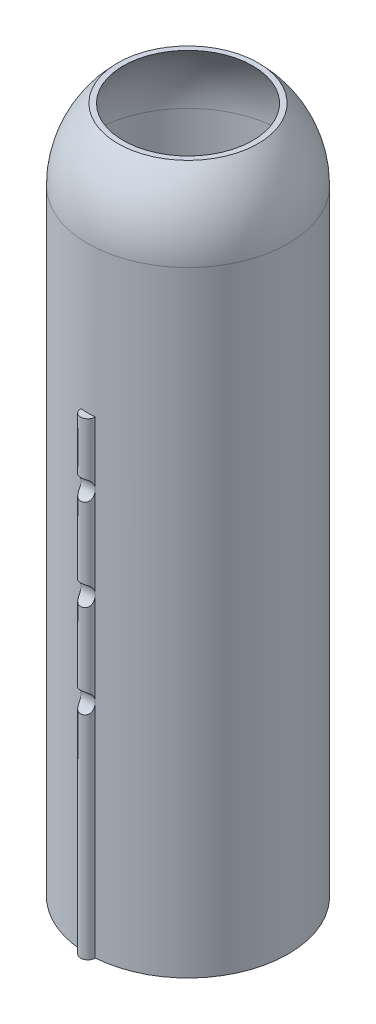
from build123d import *

# Parameters (mm, degrees)
SKETCH3_R               = 44.45
SKETCH3_R_2             = 42.06875
BOSS_EXTRUDE1_DEPTH     = 273.05
BOSS_EXTRUDE2_DEPTH     = 207.9625
CUT_EXTRUDE3_DEPTH      = 281.713814453
CUT_EXTRUDE3_DEPTH_BACK = 281.713814453
SKETCH5_R               = 4.7625
SKETCH7_R               = 3.96875
CUT_EXTRUDE4_DEPTH      = 312.684108025


with BuildPart() as part:
    # Sketch3 → Boss-Extrude1 (new body)
    with BuildSketch(Plane(origin=(0, 0, 0), x_dir=(1, 0, 0), z_dir=(0, 1, 0))):
        Circle(SKETCH3_R)
        Circle(SKETCH3_R_2, mode=Mode.SUBTRACT)
    extrude(amount=BOSS_EXTRUDE1_DEPTH)

    # Sketch3<3> → Boss-Extrude2 (add)
    with BuildSketch(Plane(origin=(0, 0, 0), x_dir=(1, 0, 0), z_dir=(0, 1, 0))):
        with BuildLine():
            ThreePointArc((-3.172974481, 44.336607143), (0, 44.45), (3.172974481, 44.336607143))
            ThreePointArc((3.172974481, 44.336607143), (0, 47.625), (-3.172974481, 44.336607143))
        make_face()
        with BuildLine():
            ThreePointArc((-3.172974481, -44.336607143), (0, -47.625), (3.172974481, -44.336607143))
            ThreePointArc((3.172974481, -44.336607143), (0, -44.45), (-3.172974481, -44.336607143))
        make_face()
    extrude(amount=BOSS_EXTRUDE2_DEPTH)

    # Sketch5 → Cut-Extrude3 (cut, two sides: drawn at the far end of the back side and taken through both)
    with BuildSketch(Plane.ZY.offset(-CUT_EXTRUDE3_DEPTH_BACK)):
        with Locations((-49.099107143, 98.425)):
            Circle(SKETCH5_R)
        with Locations((-49.099107143, 139.7)):
            Circle(SKETCH5_R)
        with Locations((-49.099107143, 180.18125)):
            Circle(SKETCH5_R)
        with Locations((49.099107143, 180.18125)):
            Circle(SKETCH5_R)
        with Locations((49.099107143, 139.7)):
            Circle(SKETCH5_R)
        with Locations((49.099107143, 98.425)):
            Circle(SKETCH5_R)
    extrude(amount=CUT_EXTRUDE3_DEPTH + CUT_EXTRUDE3_DEPTH_BACK, mode=Mode.SUBTRACT)

    # Sketch6 → Revolve1 (revolve)
    with BuildSketch(Plane.XY):
        with BuildLine():
            Line((-44.45, 273.05), (-42.06875, 273.05))
            ThreePointArc((-42.06875, 273.05), (-38.597867866, 290.26959346), (-28.727269733, 304.8))
            Line((-28.727269733, 304.8), (-31.108519733, 304.8))
            ThreePointArc((-31.108519733, 304.8), (-40.979117866, 290.26959346), (-44.45, 273.05))
        make_face()
    revolve(axis=Axis((0, 273.05, 0), (0, 1, 0)))

    # Sketch7 → Cut-Extrude4 (cut, through all)
    with BuildSketch(Plane(origin=(0, 0, 0), x_dir=(0, 0, -1), z_dir=(1, 0, 0))):
        with Locations((0, 249.2375)):
            Circle(SKETCH7_R)
    extrude(amount=-CUT_EXTRUDE4_DEPTH, mode=Mode.SUBTRACT)


solid = part.part
